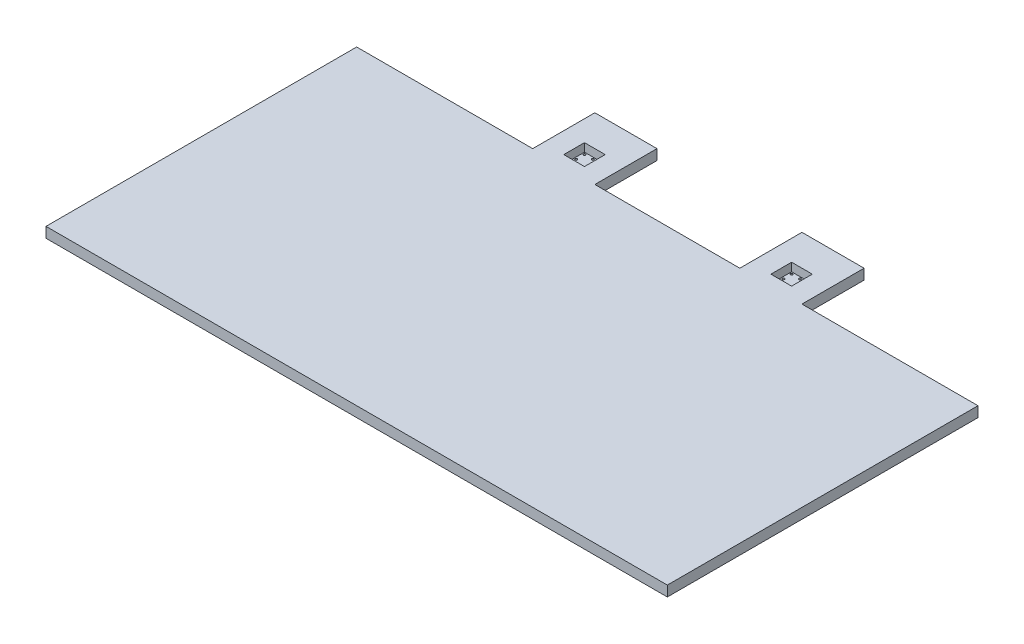
from build123d import *

# Parameters (mm, degrees)
EXTRUDE_1_DEPTH     = 10
SKETCH_2_W          = 20
SKETCH_2_H          = 20
SKETCH_2_R          = 1.05
CUT_EXTRUDE_1_DEPTH = 8
SKETCH_2_4_R        = 1.05
CUT_EXTRUDE_3_DEPTH = 367.33318168


with BuildPart() as part:
    # 草圖1 → 填料-伸長1 (new body)
    with BuildSketch(Plane(origin=(0, 0, 0), x_dir=(1, 0, 0), z_dir=(0, 1, 0))):
        Polygon((-300, -150), (300, -150), (300, 150), (130, 150), (130, 210), (70, 210), (70, 150), (-70, 150), (-70, 210), (-130, 210), (-130, 150), (-300, 150), align=None)
    extrude(amount=EXTRUDE_1_DEPTH)

    # 草圖2 → 除料-伸長1 (cut)
    # profile 1 of 2: a face of its own
    with BuildSketch(Plane(origin=(0, 10, 0), x_dir=(1, 0, 0), z_dir=(0, 1, 0))):
        with Locations((-100, 170)):
            Rectangle(SKETCH_2_W, SKETCH_2_H)
        with Locations((-108, 162)):
            Circle(SKETCH_2_R, mode=Mode.SUBTRACT)
        with Locations((-100, 162)):
            Circle(SKETCH_2_R, mode=Mode.SUBTRACT)
        with Locations((-92, 162)):
            Circle(SKETCH_2_R, mode=Mode.SUBTRACT)
        with Locations((-108, 170)):
            Circle(SKETCH_2_R, mode=Mode.SUBTRACT)
        with Locations((-92, 170)):
            Circle(SKETCH_2_R, mode=Mode.SUBTRACT)
        with Locations((-108, 178)):
            Circle(SKETCH_2_R, mode=Mode.SUBTRACT)
        with Locations((-100, 178)):
            Circle(SKETCH_2_R, mode=Mode.SUBTRACT)
        with Locations((-92, 178)):
            Circle(SKETCH_2_R, mode=Mode.SUBTRACT)
    # profile 2 of 2: a face of its own
    with BuildSketch(Plane(origin=(0, 10, 0), x_dir=(1, 0, 0), z_dir=(0, 1, 0))):
        with Locations((100, 170)):
            Rectangle(SKETCH_2_W, SKETCH_2_H)
        with Locations((92, 162)):
            Circle(SKETCH_2_R, mode=Mode.SUBTRACT)
        with Locations((100, 162)):
            Circle(SKETCH_2_R, mode=Mode.SUBTRACT)
        with Locations((108, 162)):
            Circle(SKETCH_2_R, mode=Mode.SUBTRACT)
        with Locations((92, 170)):
            Circle(SKETCH_2_R, mode=Mode.SUBTRACT)
        with Locations((108, 170)):
            Circle(SKETCH_2_R, mode=Mode.SUBTRACT)
        with Locations((92, 178)):
            Circle(SKETCH_2_R, mode=Mode.SUBTRACT)
        with Locations((100, 178)):
            Circle(SKETCH_2_R, mode=Mode.SUBTRACT)
        with Locations((108, 178)):
            Circle(SKETCH_2_R, mode=Mode.SUBTRACT)
    extrude(amount=-CUT_EXTRUDE_1_DEPTH, mode=Mode.SUBTRACT)

    # 草圖2<4> → 除料-伸長3 (cut, through all)
    with BuildSketch(Plane(origin=(0, 10, 0), x_dir=(1, 0, 0), z_dir=(0, 1, 0))):
        with Locations((-108, 178)):
            Circle(SKETCH_2_4_R)
        with Locations((-92, 178)):
            Circle(SKETCH_2_4_R)
        with Locations((-92, 162)):
            Circle(SKETCH_2_4_R)
        with Locations((-108, 162)):
            Circle(SKETCH_2_4_R)
        with Locations((108, 162)):
            Circle(SKETCH_2_4_R)
        with Locations((92, 162)):
            Circle(SKETCH_2_4_R)
        with Locations((92, 178)):
            Circle(SKETCH_2_4_R)
        with Locations((108, 178)):
            Circle(SKETCH_2_4_R)
        with Locations((-100, 178)):
            Circle(SKETCH_2_4_R)
        with Locations((-100, 162)):
            Circle(SKETCH_2_4_R)
        with Locations((-108, 170)):
            Circle(SKETCH_2_4_R)
        with Locations((-92, 170)):
            Circle(SKETCH_2_4_R)
        with Locations((108, 170)):
            Circle(SKETCH_2_4_R)
        with Locations((100, 162)):
            Circle(SKETCH_2_4_R)
        with Locations((92, 170)):
            Circle(SKETCH_2_4_R)
        with Locations((100, 178)):
            Circle(SKETCH_2_4_R)
    extrude(amount=-CUT_EXTRUDE_3_DEPTH, mode=Mode.SUBTRACT)


solid = part.part
